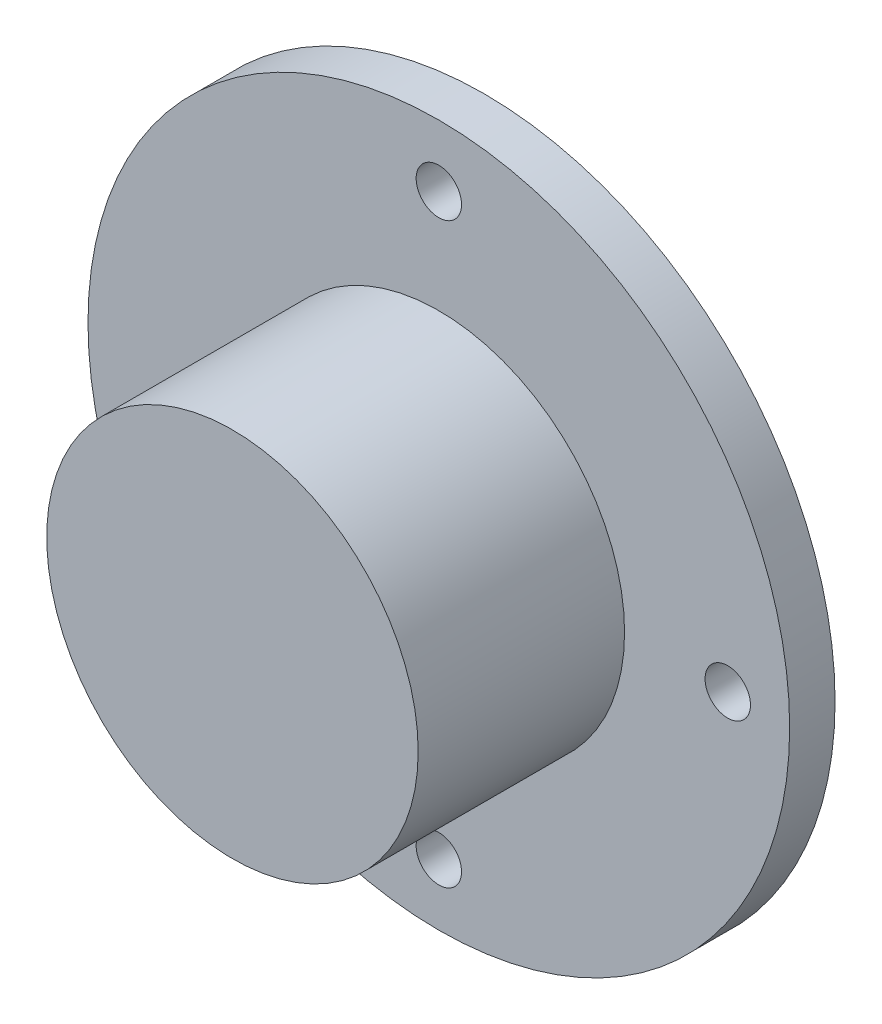
from build123d import *

# Parameters (mm, degrees)
OUTER_RACE_KEEPER_FLANGE_PROFILE_R             = 17
OUTER_RACE_KEEPER_FLANGE_DEPTH                 = 2
HOUSING_CONTACT_RIM_PRESERVES_BEARING_FL_START = -0.2
HOUSING_CONTACT_RIM_PRESERVES_BEARIN_2_R       = 17
HOUSING_CONTACT_RIM_PRESERVES_BEARIN_2_R_2     = 11.2
HOUSING_CONTACT_RIM_PRESERVES_BEARING_FL_DEPTH = 0.2
PIN_END_COVER_PROFILE_R                        = 9
PIN_END_COVER_DEPTH                            = 12
DOWEL_END_FLOAT_POCKET_PROFILE_R               = 7
DOWEL_END_FLOAT_POCKET_DEPTH9_DEPTH            = 9
KEEPER_M2_FASTENERS_START                      = -50
KEEPER_M2_FASTENERS_PROFILE_R                  = 1.1
KEEPER_M2_FASTENERS_DEPTH                      = 77.870057685


with BuildPart() as part:
    # Outer_race_keeper_flange_profile → Outer_race_keeper_flange (new body)
    with BuildSketch(Plane.XY):
        Circle(OUTER_RACE_KEEPER_FLANGE_PROFILE_R)
    extrude(amount=OUTER_RACE_KEEPER_FLANGE_DEPTH)

    # Housing_contact_rim_preserves_bearin 2 → Housing_contact_rim_preserves_bearing_fl (add)
    with BuildSketch(Plane.XY.offset(HOUSING_CONTACT_RIM_PRESERVES_BEARING_FL_START)):
        Circle(HOUSING_CONTACT_RIM_PRESERVES_BEARIN_2_R)
        Circle(HOUSING_CONTACT_RIM_PRESERVES_BEARIN_2_R_2, mode=Mode.SUBTRACT)
    extrude(amount=HOUSING_CONTACT_RIM_PRESERVES_BEARING_FL_DEPTH)

    # Pin_end_cover_profile → Pin_end_cover (add)
    with BuildSketch(Plane.XY):
        Circle(PIN_END_COVER_PROFILE_R)
    extrude(amount=PIN_END_COVER_DEPTH)

    # Dowel_end_float_pocket_profile → Dowel_end_float_pocket_depth9 (cut)
    with BuildSketch(Plane.XY):
        Circle(DOWEL_END_FLOAT_POCKET_PROFILE_R)
    extrude(amount=DOWEL_END_FLOAT_POCKET_DEPTH9_DEPTH, mode=Mode.SUBTRACT)

    # Keeper_M2_fasteners_profile → Keeper_M2_fasteners (cut, through all)
    with BuildSketch(Plane.XY.offset(KEEPER_M2_FASTENERS_START)):
        with Locations((14, 0)):
            Circle(KEEPER_M2_FASTENERS_PROFILE_R)
        with Locations((0, -14)):
            Circle(KEEPER_M2_FASTENERS_PROFILE_R)
        with Locations((0, 14)):
            Circle(KEEPER_M2_FASTENERS_PROFILE_R)
    extrude(amount=KEEPER_M2_FASTENERS_DEPTH, mode=Mode.SUBTRACT)


solid = part.part
